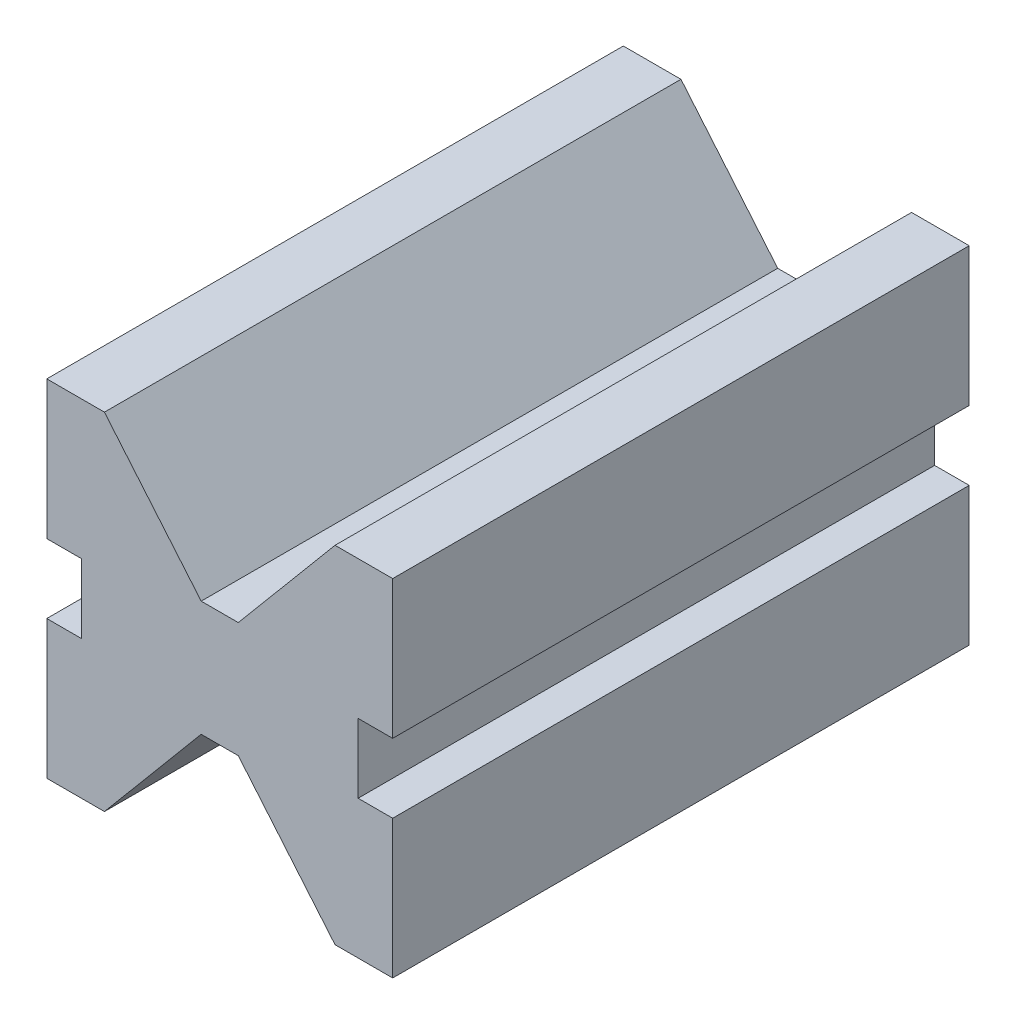
from build123d import *

# Parameters (mm, degrees)
BOSS_EXTRUDE1_DEPTH = 100


with BuildPart() as part:
    # Sketch1 → Boss-Extrude1 (new body)
    with BuildSketch(Plane.XY):
        Polygon((-20, 0), (-30, 0), (-30, 24), (-24, 24), (-24, 36), (-30, 36), (-30, 60), (-20, 60), (-3.218007376, 40), (3.218007376, 40), (20, 60), (30, 60), (30, 36), (24, 36), (24, 24), (30, 24), (30, 0), (20, 0), (3.218007376, 20), (-3.218007376, 20), align=None)
    extrude(amount=-BOSS_EXTRUDE1_DEPTH)


solid = part.part
